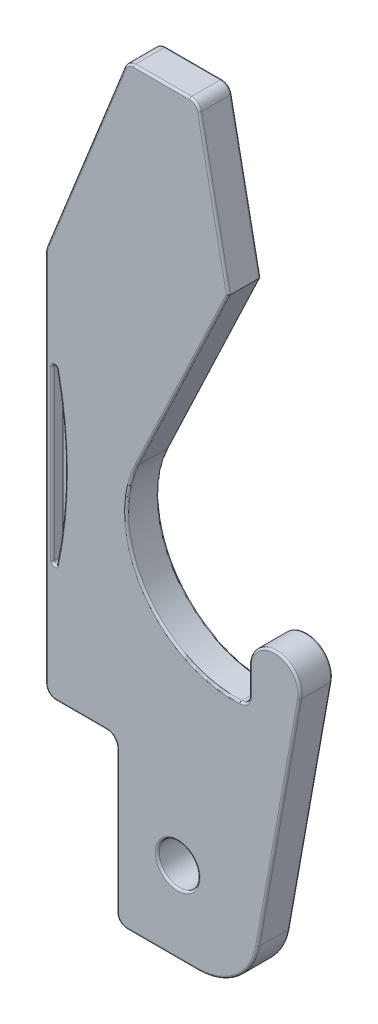
from build123d import *

# Parameters (mm, degrees)
BOSS_EXTRUDE1_DEPTH = 1.6
FILLET1_R           = 3
SKETCH2_R           = 1
SKETCH2_W           = 3.5
SKETCH2_H           = 8
CUT_EXTRUDE1_DEPTH  = 40.093412924
FILLET2_R           = 0.5
FILLET3_R           = 0.1
CUT_EXTRUDE2_DEPTH  = 0.5
FILLET4_R           = 0.1
FILLET5_R           = 0.1


with BuildPart() as part:
    # Sketch1 → Boss-Extrude1 (new body)
    with BuildSketch(Plane.XY):
        with BuildLine():
            Line((0, 0), (0, 27))
            Line((0, 27), (4, 37))
            Line((4, 37), (7.5, 37))
            Line((7.5, 37), (9, 29.5))
            Line((9, 29.5), (4.496932826, 20))
            ThreePointArc((4.496932826, 20), (5.02742047, 14.61054605), (10.033838602, 12.545743759))
            Line((10.033838602, 12.545743759), (10.033838602, 14.439556556))
            ThreePointArc((10.033838602, 14.439556556), (11.473811391, 15.483170207), (12.5, 14.030728118))
            Line((12.5, 14.030728118), (10, 0))
            Line((10, 0), (0, 0))
        make_face()
    extrude(amount=BOSS_EXTRUDE1_DEPTH)

    # Fillet1
    fillet1_edges = [part.edges().sort_by_distance(p)[0] for p in [
        (10, 0, 0.8),
    ]]
    fillet(fillet1_edges, radius=FILLET1_R)

    # Sketch2 → Cut-Extrude1 (cut, through all)
    with BuildSketch(Plane.XY.offset(1.6)):
        with Locations((6.5, 4)):
            Circle(SKETCH2_R)
        with Locations((1.75, 4)):
            Rectangle(SKETCH2_W, SKETCH2_H)
    extrude(amount=-CUT_EXTRUDE1_DEPTH, mode=Mode.SUBTRACT)

    # Fillet2
    fillet2_edges = [part.edges().sort_by_distance(p)[0] for p in [
        (0, 27, 0.8),
        (4, 37, 0.8),
        (7.5, 37, 0.8),
        (10.033838602, 12.545743759, 0.8),
        (0, 8, 0.8),
        (3.5, 8, 0.8),
        (3.5, 0, 0.8),
    ]]
    fillet(fillet2_edges, radius=FILLET2_R)

    # Fillet3
    fillet3_edges = [part.edges().sort_by_distance(p)[0] for p in [
        (8.290194193, 33.049029034, 0),
        (6.748466413, 24.75, 0),
        (10.033838602, 13.717519643, 0),
        (11.473811391, 15.483170207, 1.6),
        (11.473811391, 15.483170207, 0),
        (10.033838602, 13.717519643, 1.6),
        (6.748466413, 24.75, 1.6),
        (8.290194193, 33.049029034, 1.6),
        (11.470386592, 8.2522378, 0),
        (11.470386592, 8.2522378, 1.6),
        (9.413588067, 0.700135052, 0),
        (9.413588067, 0.700135052, 1.6),
        (5.5, 4, 0),
        (5.5, 4, 1.6),
        (4.890733451, 14.803478085, 0),
        (4.890733451, 14.803478085, 1.6),
        (5.714307265, 37, 0),
        (5.714307265, 37, 1.6),
        (3.5, 4, 0),
        (1.75, 8, 0),
        (0, 17.701854399, 0),
        (1.955019895, 31.887549737, 0),
        (5.743645392, 0, 0),
        (0.146446609, 8.146446609, 0),
        (3.646446609, 0.146446609, 0),
        (0.009021807, 26.998262559, 0),
        (4.058202076, 36.914033615, 0),
        (7.407092501, 36.886671071, 0),
        (1.75, 8, 1.6),
        (3.5, 4, 1.6),
        (5.743645392, 0, 1.6),
        (1.955019895, 31.887549737, 1.6),
        (0, 17.701854399, 1.6),
        (0.146446609, 8.146446609, 1.6),
        (3.646446609, 0.146446609, 1.6),
        (0.009021807, 26.998262559, 1.6),
        (4.058202076, 36.914033615, 1.6),
        (7.407092501, 36.886671071, 1.6),
        (9.897780554, 12.652632536, 0),
        (9.897780554, 12.652632536, 1.6),
        (3.353553391, 7.853553391, 1.6),
        (3.353553391, 7.853553391, 0),
    ]]
    fillet(fillet3_edges, radius=FILLET3_R)

    # Sketch3 → Cut-Extrude2 (cut)
    with BuildSketch(Plane.XY.offset(1.6)):
        with BuildLine():
            Line((0.35, 23), (0.35, 13))
            ThreePointArc((0.35, 13), (0.985083269, 18), (0.35, 23))
        make_face()
    extrude(amount=-CUT_EXTRUDE2_DEPTH, mode=Mode.SUBTRACT)

    # Fillet4
    fillet4_edges = [part.edges().sort_by_distance(p)[0] for p in [
        (0.35, 23, 1.35),
        (0.35, 13, 1.35),
    ]]
    fillet(fillet4_edges, radius=FILLET4_R)

    # Fillet5
    fillet5_edges = [part.edges().sort_by_distance(p)[0] for p in [
        (0.985083269, 18, 1.6),
        (0.35, 18, 1.6),
        (0.439544504, 13.762068096, 1.6),
        (0.439544504, 22.237931904, 1.6),
    ]]
    fillet(fillet5_edges, radius=FILLET5_R)


solid = part.part
